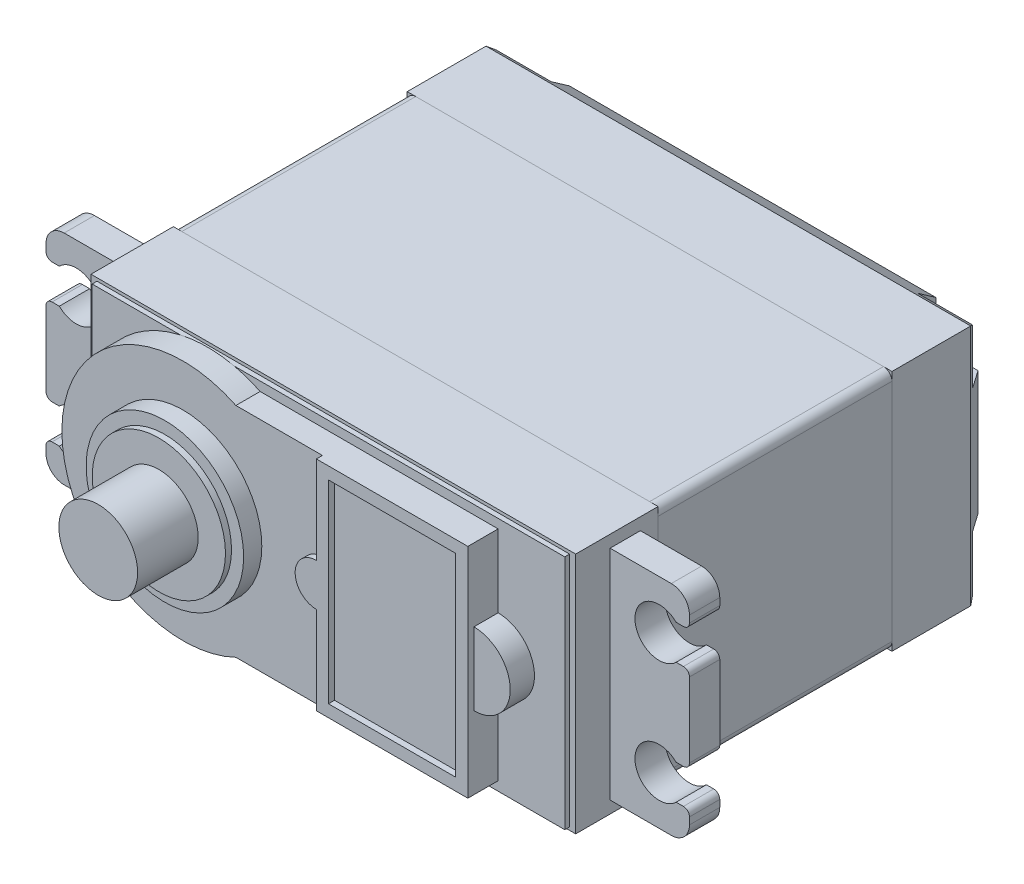
from build123d import *
from OCP.BRepFilletAPI import BRepFilletAPI_MakeChamfer

# Parameters (mm, degrees)
SKETCH1_W            = 40
SKETCH1_H            = 20
BOSS_EXTRUDE1_DEPTH  = 19.3
SKETCH2_W            = 40
SKETCH2_H            = 20
BOSS_EXTRUDE2_DEPTH  = 6.8
SKETCH3_W            = 40
SKETCH3_H            = 20
BOSS_EXTRUDE3_DEPTH  = 8.5
CHAMFER1_SIZE        = 2
CHAMFER1_SIZE2       = 1.400415076
CUT_EXTRUDE1_DEPTH   = 1.5
SKETCH5_W            = 39
SKETCH5_H            = 19.5
BOSS_EXTRUDE5_DEPTH  = 0.4
BOSS_EXTRUDE6_DEPTH  = 2
SKETCH7_R            = 6.5
BOSS_EXTRUDE7_DEPTH  = 1.5
SKETCH8_R            = 5.5
BOSS_EXTRUDE8_DEPTH  = 0.5
SKETCH9_R            = 3.25
BOSS_EXTRUDE9_DEPTH  = 5
SKETCH10_W           = 10.5
SKETCH10_H           = 15.998933302
BOSS_EXTRUDE10_DEPTH = 0.5
FILLET1_R            = 0.7
BOSS_EXTRUDE11_START = -5.74
BOSS_EXTRUDE11_DEPTH = 2.5


with BuildPart() as part:
    # Sketch1 → Boss-Extrude1 (new body)
    with BuildSketch(Plane.XY):
        Rectangle(SKETCH1_W, SKETCH1_H)
    extrude(amount=BOSS_EXTRUDE1_DEPTH)

    # Fillet1
    fillet1_edges = [part.edges().sort_by_distance(p)[0] for p in [
        (20, -10, 9.65),
        (-20, -10, 9.65),
        (-20, 10, 9.65),
        (20, 10, 9.65),
    ]]
    fillet(fillet1_edges, radius=FILLET1_R)


with BuildPart() as body_2:
    # Sketch2 → Boss-Extrude2 (new body)
    with BuildSketch(Plane.XY.offset(19.3)):
        Rectangle(SKETCH2_W, SKETCH2_H)
    extrude(amount=BOSS_EXTRUDE2_DEPTH)

    # Sketch5 → Boss-Extrude5 (add)
    with BuildSketch(Plane.XY.offset(26.1)):
        Rectangle(SKETCH5_W, SKETCH5_H)
    extrude(amount=BOSS_EXTRUDE5_DEPTH)

    # Sketch6 → Boss-Extrude6 (add)
    with BuildSketch(Plane.XY.offset(26.5)):
        with BuildLine():
            Line((-5.64, 8.999466651), (14, 8.999466651))
            Line((14, 8.999466651), (14, 3))
            ThreePointArc((14, 3), (17, 0), (14, -3))
            Line((14, -3), (14, -8.999466651))
            Line((14, -8.999466651), (-5.64, -8.999466651))
            ThreePointArc((-5.64, -8.999466651), (-20, 0), (-5.64, 8.999466651))
        make_face()
    extrude(amount=BOSS_EXTRUDE6_DEPTH)

    # Sketch7 → Boss-Extrude7 (add)
    with BuildSketch(Plane.XY.offset(28.5)):
        with Locations((-10, 0)):
            Circle(SKETCH7_R)
    extrude(amount=BOSS_EXTRUDE7_DEPTH)

    # Sketch8 → Boss-Extrude8 (add)
    with BuildSketch(Plane.XY.offset(30)):
        with Locations((-10, 0)):
            Circle(SKETCH8_R)
    extrude(amount=BOSS_EXTRUDE8_DEPTH)

    # Sketch9 → Boss-Extrude9 (add)
    with BuildSketch(Plane.XY.offset(30.5)):
        with Locations((-10, 0)):
            Circle(SKETCH9_R)
    extrude(amount=BOSS_EXTRUDE9_DEPTH)

    # Sketch10 → Boss-Extrude10 (add)
    with BuildSketch(Plane.XY.offset(28.5)):
        with BuildLine():
            Line((14, 8.999466651), (1.5, 8.999466651))
            Line((1.5, 8.999466651), (1.5, 1.75))
            ThreePointArc((1.5, 1.75), (-0.25, 0), (1.5, -1.75))
            Line((1.5, -1.75), (1.5, -8.999466651))
            Line((1.5, -8.999466651), (14, -8.999466651))
            Line((14, -8.999466651), (14, 8.999466651))
        make_face()
        with Locations((7.75, 0)):
            Rectangle(SKETCH10_W, SKETCH10_H, mode=Mode.SUBTRACT)
    extrude(amount=BOSS_EXTRUDE10_DEPTH)

    # Sketch11 → Boss-Extrude11 (add)
    with BuildSketch(Plane.XY.offset(26.5).offset(BOSS_EXTRUDE11_START)):
        with BuildLine():
            Line((20, 9), (25.05, 9))
            ThreePointArc((25.05, 9), (26.110660172, 8.560660172), (26.55, 7.5))
            Line((26.55, 7.5), (26.55, 6.928285686))
            ThreePointArc((26.55, 6.928285686), (26.403553391, 6.574732295), (26.05, 6.428285686))
            Line((26.05, 6.428285686), (25.45, 6.428285686))
            ThreePointArc((25.45, 6.428285686), (22.05, 5), (25.45, 3.571714314))
            Line((25.45, 3.571714314), (26.05, 3.571714314))
            ThreePointArc((26.05, 3.571714314), (26.403553391, 3.425267705), (26.55, 3.071714314))
            Line((26.55, 3.071714314), (26.55, -3.071714314))
            ThreePointArc((26.55, -3.071714314), (26.403553391, -3.425267705), (26.05, -3.571714314))
            Line((26.05, -3.571714314), (25.45, -3.571714314))
            ThreePointArc((25.45, -3.571714314), (22.05, -5), (25.45, -6.428285686))
            Line((25.45, -6.428285686), (26.05, -6.428285686))
            ThreePointArc((26.05, -6.428285686), (26.403553391, -6.574732295), (26.55, -6.928285686))
            Line((26.55, -6.928285686), (26.55, -7.5))
            ThreePointArc((26.55, -7.5), (26.110660172, -8.560660172), (25.05, -9))
            Line((25.05, -9), (20, -9))
            Line((20, -9), (20, 9))
        make_face()
    boss_extrude11 = extrude(amount=BOSS_EXTRUDE11_DEPTH)

    # Mirror1: Boss-Extrude11 across plane
    add(boss_extrude11.mirror(Plane(origin=(0, 0, 0), x_dir=(0, 0, 1), z_dir=(1, 0, 0))))


with BuildPart() as body_3:
    # Sketch3 → Boss-Extrude3 (new body)
    with BuildSketch(Plane(origin=(0, 0, 0), x_dir=(-1, 0, 0), z_dir=(0, 0, -1))):
        Rectangle(SKETCH3_W, SKETCH3_H)
    extrude(amount=BOSS_EXTRUDE3_DEPTH)

    # Chamfer1: one chamfer whose edges measure the first distance from different faces: ONE call of the kernel's chamfer builder (chamfer() names one face for all edges)
    chamfer1_edges_1 = [body_3.edges().sort_by_distance(p)[0] for p in [
        (0, -10, -8.5),
    ]]
    chamfer1_side_1 = [body_3.faces().sort_by_distance(p)[0] for p in [
        (0, -10, -4.25),
    ]]
    chamfer1_edges_2 = [body_3.edges().sort_by_distance(p)[0] for p in [
        (-20, 0, -8.5),
    ]]
    chamfer1_side_2 = [body_3.faces().sort_by_distance(p)[0] for p in [
        (-20, 0, -4.25),
    ]]
    chamfer1_edges_3 = [body_3.edges().sort_by_distance(p)[0] for p in [
        (0, 10, -8.5),
    ]]
    chamfer1_side_3 = [body_3.faces().sort_by_distance(p)[0] for p in [
        (0, 10, -4.25),
    ]]
    chamfer1_edges_4 = [body_3.edges().sort_by_distance(p)[0] for p in [
        (20, 0, -8.5),
    ]]
    chamfer1_side_4 = [body_3.faces().sort_by_distance(p)[0] for p in [
        (20, 0, -4.25),
    ]]
    chamfer1 = BRepFilletAPI_MakeChamfer(body_3.part.solid().wrapped)
    for e in chamfer1_edges_1:
        chamfer1.Add(CHAMFER1_SIZE, CHAMFER1_SIZE2, e.wrapped, chamfer1_side_1[0].wrapped)  # the first distance lies on this face
    for e in chamfer1_edges_2:
        chamfer1.Add(CHAMFER1_SIZE, CHAMFER1_SIZE2, e.wrapped, chamfer1_side_2[0].wrapped)  # the first distance lies on this face
    for e in chamfer1_edges_3:
        chamfer1.Add(CHAMFER1_SIZE, CHAMFER1_SIZE2, e.wrapped, chamfer1_side_3[0].wrapped)  # the first distance lies on this face
    for e in chamfer1_edges_4:
        chamfer1.Add(CHAMFER1_SIZE, CHAMFER1_SIZE2, e.wrapped, chamfer1_side_4[0].wrapped)  # the first distance lies on this face
    add(Compound.cast(chamfer1.Shape()), mode=Mode.REPLACE)

    # Sketch4 → Cut-Extrude1 (cut)
    with BuildSketch(Plane(origin=(0, 0, -8.5), x_dir=(-1, 0, 0), z_dir=(0, 0, -1))):
        with BuildLine():
            Line((-20, 10), (-15.12, 10))
            Line((-15.12, 10), (-15.12, 7.115114037))
            ThreePointArc((-15.12, 7.115114037), (-15.705786438, 5.700900474), (-17.12, 5.115114037))
            Line((-17.12, 5.115114037), (-20, 5.115114037))
            Line((-20, 5.115114037), (-20, 10))
        make_face()
        with BuildLine():
            Line((20, 5.115114037), (17.12, 5.115114037))
            ThreePointArc((17.12, 5.115114037), (15.705786438, 5.700900474), (15.12, 7.115114037))
            Line((15.12, 7.115114037), (15.12, 10))
            Line((15.12, 10), (20, 10))
            Line((20, 10), (20, 5.115114037))
        make_face()
        with BuildLine():
            Line((20, -10), (20, -5.115114037))
            Line((20, -5.115114037), (17.12, -5.115114037))
            ThreePointArc((17.12, -5.115114037), (15.705786438, -5.700900474), (15.12, -7.115114037))
            Line((15.12, -7.115114037), (15.12, -10))
            Line((15.12, -10), (20, -10))
        make_face()
        with BuildLine():
            Line((-20, -5.115114037), (-17.12, -5.115114037))
            ThreePointArc((-17.12, -5.115114037), (-15.705786438, -5.700900474), (-15.12, -7.115114037))
            Line((-15.12, -7.115114037), (-15.12, -10))
            Line((-15.12, -10), (-20, -10))
            Line((-20, -10), (-20, -5.115114037))
        make_face()
    extrude(amount=-CUT_EXTRUDE1_DEPTH, mode=Mode.SUBTRACT)


solid = Compound([part.part, body_2.part, body_3.part])
